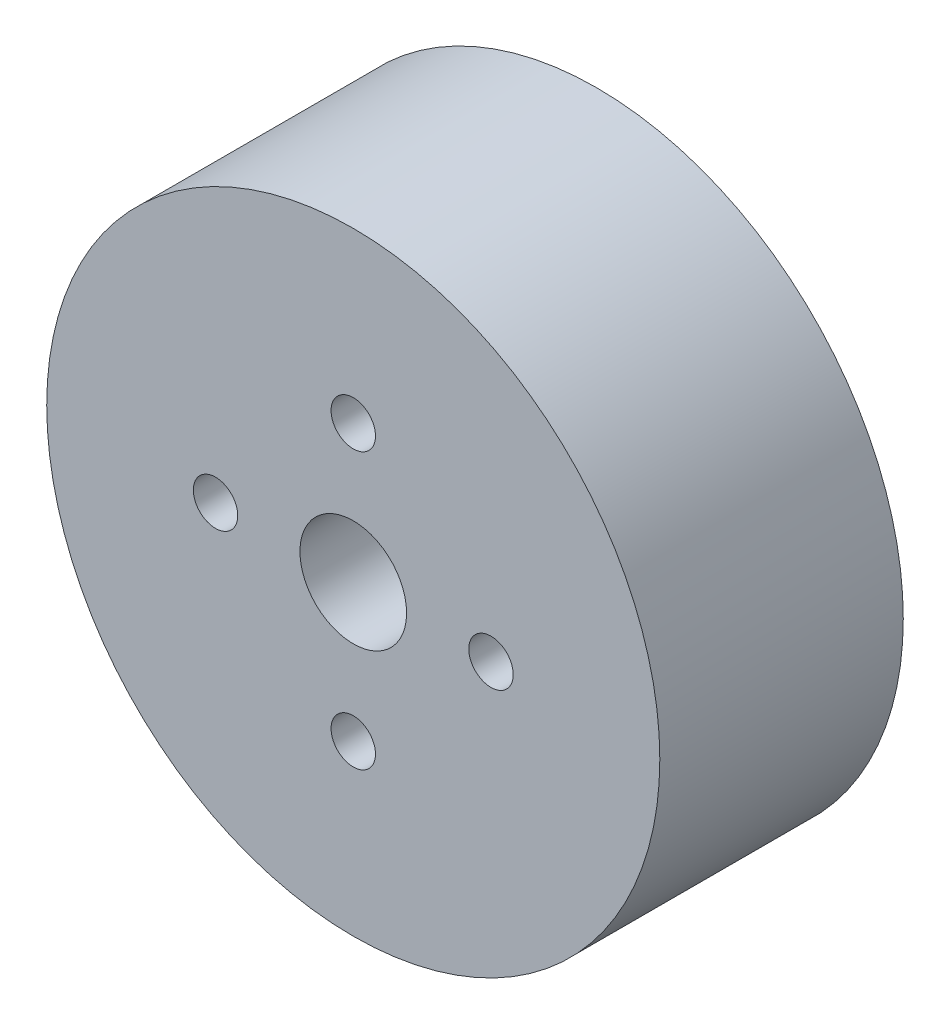
from build123d import *

# Parameters (mm, degrees)
SKETCH_1_R          = 17.25
EXTRUDE_1_DEPTH     = 13.7
SKETCH_2_R          = 1.25
CUT_EXTRUDE_1_DEPTH = 3
CUT_EXTRUDE_START   = 3
SKETCH_3_R          = 1.25
CUT_EXTRUDE_2_DEPTH = 3
SKETCH_4_R          = 6.25
SKETCH_4_R_2        = 4.25
CUT_EXTRUDE_3_DEPTH = 2
SKETCH_5_R          = 3.25
CUT_EXTRUDE_4_DEPTH = 0.7
FILLET_1_R          = 0.3
SKETCH_6_R          = 3
CUT_EXTRUDE_6_DEPTH = 11


with BuildPart() as part:
    # 草图1 → 凸台-拉伸1 (new body)
    with BuildSketch(Plane.XY):
        with Locations(Location((0, 0, 0), (0, 0, 180))):
            Circle(SKETCH_1_R)
    extrude(amount=EXTRUDE_1_DEPTH)

    # 草图2 → 切除-拉伸1 (cut)
    with BuildSketch(Plane.XY.offset(13.7)):
        with Locations((0, 7.75)):
            Circle(SKETCH_2_R)
        with Locations((7.75, 0)):
            Circle(SKETCH_2_R)
        with Locations((0, -7.75)):
            Circle(SKETCH_2_R)
        with Locations((-7.75, 0)):
            Circle(SKETCH_2_R)
    extrude(amount=-CUT_EXTRUDE_1_DEPTH, mode=Mode.SUBTRACT)

    # 草图3 → 切除-拉伸2 (cut)
    with BuildSketch(Plane.XY.offset(CUT_EXTRUDE_START)):
        with Locations((0, 7.75)):
            Circle(SKETCH_3_R)
        with Locations((7.75, 0)):
            Circle(SKETCH_3_R)
        with Locations((0, -7.75)):
            Circle(SKETCH_3_R)
        with Locations((-7.75, 0)):
            Circle(SKETCH_3_R)
    extrude(amount=-CUT_EXTRUDE_2_DEPTH, mode=Mode.SUBTRACT)

    # 草图4 → 切除-拉伸3 (cut)
    with BuildSketch(Plane.XY):
        Circle(SKETCH_4_R)
        Circle(SKETCH_4_R_2, mode=Mode.SUBTRACT)
    extrude(amount=CUT_EXTRUDE_3_DEPTH, mode=Mode.SUBTRACT)

    # 草图5 → 切除-拉伸4 (cut)
    with BuildSketch(Plane.XY):
        Circle(SKETCH_5_R)
    extrude(amount=CUT_EXTRUDE_4_DEPTH, mode=Mode.SUBTRACT)

    # 圆角1
    fillet_1_edges = [part.edges().sort_by_distance(p)[0] for p in [
        (-4.25, 0, 0),
        (-3.25, 0, 0),
    ]]
    fillet(fillet_1_edges, radius=FILLET_1_R)

    # 草图6 → 切除-拉伸6 (cut)
    with BuildSketch(Plane.XY.offset(13.7)):
        Circle(SKETCH_6_R)
    extrude(amount=-CUT_EXTRUDE_6_DEPTH, mode=Mode.SUBTRACT)


solid = part.part
